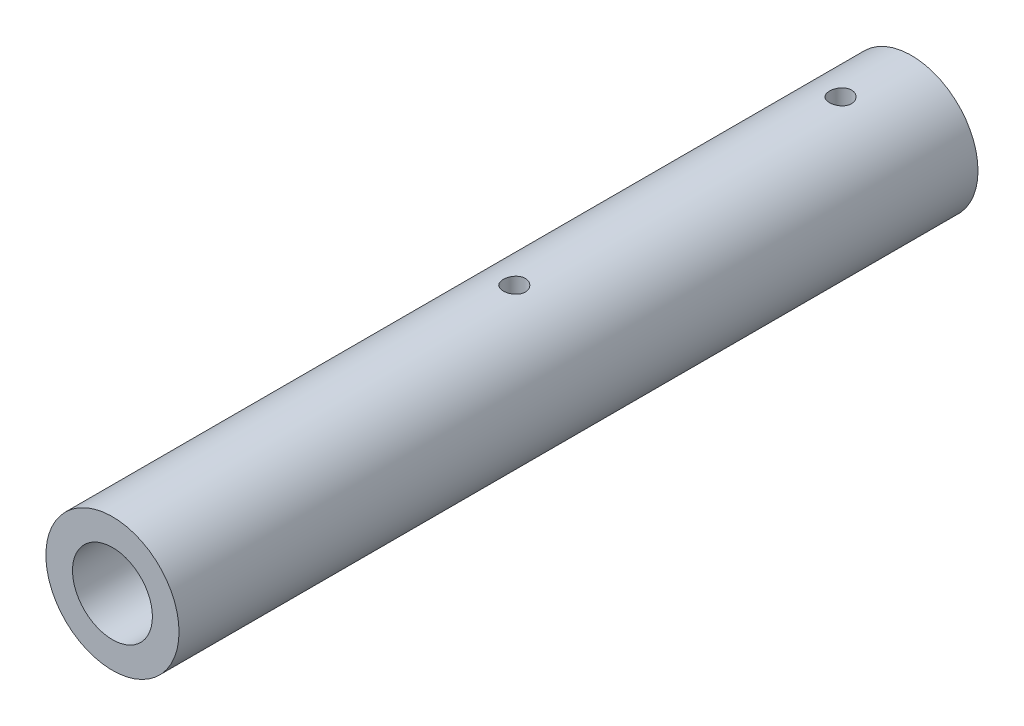
from build123d import *

# Parameters (mm, degrees)
SKETCH_1_R               = 10
SKETCH_1_R_2             = 6
EXTRUDE_1_DEPTH          = 120
CUT_EXTRUDE_1_DEPTH      = 121.830459736
CUT_EXTRUDE_1_DEPTH_BACK = 121.830459736
SKETCH_2_R               = 1.65


with BuildPart() as part:
    # Эскиз1 → Бобышка-Вытянуть1 (new body)
    with BuildSketch(Plane.XY):
        Circle(SKETCH_1_R)
        Circle(SKETCH_1_R_2, mode=Mode.SUBTRACT)
    extrude(amount=EXTRUDE_1_DEPTH)

    # Эскиз2 → Вырез-Вытянуть1 (cut, two sides: drawn at the far end of the back side and taken through both)
    with BuildSketch(Plane(origin=(0, 0, 0), x_dir=(1, 0, 0), z_dir=(0, 1, 0)).offset(-CUT_EXTRUDE_1_DEPTH_BACK)):
        with Locations(Location((0, -10.65, 0), (0, 0, 270))):
            Circle(SKETCH_2_R)
        with Locations(Location((0, -59.65, 0), (0, 0, 270))):
            Circle(SKETCH_2_R)
    extrude(amount=CUT_EXTRUDE_1_DEPTH + CUT_EXTRUDE_1_DEPTH_BACK, mode=Mode.SUBTRACT)


solid = part.part
